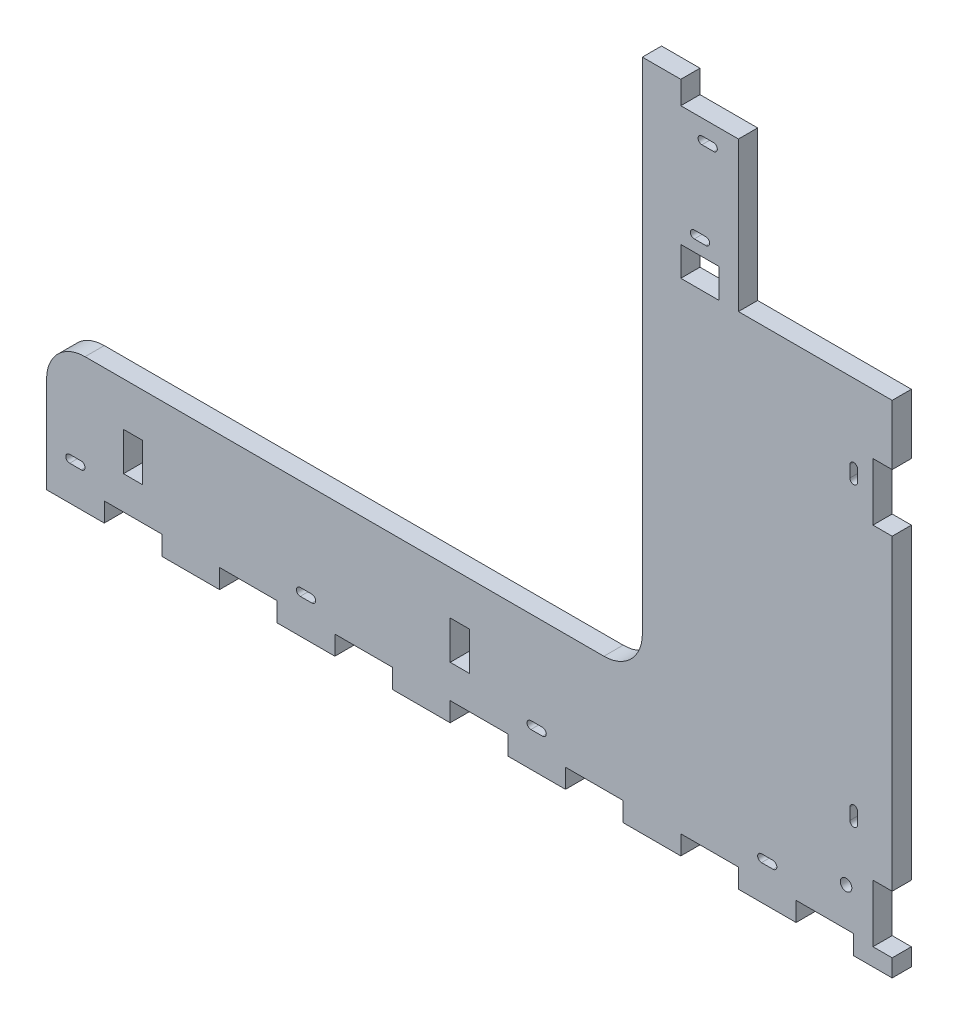
from build123d import *

# Parameters (mm, degrees)
SKETCH1_W           = 220
SKETCH1_H           = 175
BOSS_EXTRUDE1_DEPTH = 5
SKETCH2_W           = 15
SKETCH2_H           = 5
CUT_EXTRUDE1_DEPTH  = 282.15831839
LPATTERN1_COUNT     = 7
LPATTERN1_PITCH     = 30
SKETCH3_W           = 15
SKETCH3_H           = 5.956499639
CUT_EXTRUDE2_DEPTH  = 282.15831839
LPATTERN2_COUNT     = 7
LPATTERN2_PITCH     = 30
SKETCH4_R           = 1.5
CUT_EXTRUDE3_DEPTH  = 282.15831839
SKETCH5_W           = 5
SKETCH5_H           = 15
CUT_EXTRUDE4_DEPTH  = 282.15831839
SKETCH7_W           = 40
SKETCH7_H           = 44.8382835
SKETCH7_W_2         = 10
SKETCH7_H_2         = 7.632708493
CUT_EXTRUDE6_DEPTH  = 282.15831839
SKETCH8_W           = 5
SKETCH8_H           = 10
CUT_EXTRUDE7_DEPTH  = 282.15831839
CUT_EXTRUDE8_DEPTH  = 282.15831839


with BuildPart() as part:
    # Sketch1 → Boss-Extrude1 (new body)
    with BuildSketch(Plane.XY):
        with Locations((-110, 87.5)):
            Rectangle(SKETCH1_W, SKETCH1_H)
    extrude(amount=BOSS_EXTRUDE1_DEPTH)

    # Sketch2 → Cut-Extrude1 (cut, through all)
    with BuildSketch(Plane.XY.offset(5)):
        with Locations((-197.5, 2.5)):
            Rectangle(SKETCH2_W, SKETCH2_H)
    cut_extrude1 = extrude(amount=-CUT_EXTRUDE1_DEPTH, mode=Mode.SUBTRACT)

    # LPattern1: Cut-Extrude1 ×7
    with Locations(*[(i * LPATTERN1_PITCH, 0, 0) for i in range(1, LPATTERN1_COUNT)]):
        add(cut_extrude1, mode=Mode.SUBTRACT)

    # Sketch3 → Cut-Extrude2 (cut, through all)
    with BuildSketch(Plane.XY.offset(5)):
        with Locations((-197.5, 172.021750181)):
            Rectangle(SKETCH3_W, SKETCH3_H)
    cut_extrude2 = extrude(amount=-CUT_EXTRUDE2_DEPTH, mode=Mode.SUBTRACT)

    # LPattern2: Cut-Extrude2 ×7
    with Locations(*[(i * LPATTERN2_PITCH, 0, 0) for i in range(1, LPATTERN2_COUNT)]):
        add(cut_extrude2, mode=Mode.SUBTRACT)

    # Sketch4 → Cut-Extrude3 (cut, through all)
    with BuildSketch(Plane.XY.offset(5)):
        with Locations((-12, 15)):
            Circle(SKETCH4_R)
    extrude(amount=-CUT_EXTRUDE3_DEPTH, mode=Mode.SUBTRACT)

    # Sketch5 → Cut-Extrude4 (cut, through all)
    with BuildSketch(Plane(origin=(0, 0, 0), x_dir=(-1, 0, 0), z_dir=(0, 0, -1))):
        with Locations((2.5, 107.048065362)):
            Rectangle(SKETCH5_W, SKETCH5_H)
        with Locations((2.5, 12.048065362)):
            Rectangle(SKETCH5_W, SKETCH5_H)
    extrude(amount=-CUT_EXTRUDE4_DEPTH, mode=Mode.SUBTRACT)

    # Sketch7 → Cut-Extrude6 (cut, through all)
    with BuildSketch(Plane.XY.offset(5)):
        with Locations((-20, 152.58085825)):
            Rectangle(SKETCH7_W, SKETCH7_H)
        with Locations((-50, 133.978070747)):
            Rectangle(SKETCH7_W_2, SKETCH7_H_2)
    extrude(amount=-CUT_EXTRUDE6_DEPTH, mode=Mode.SUBTRACT)

    # Sketch8 → Cut-Extrude7 (cut, through all)
    with BuildSketch(Plane.XY.offset(5)):
        with BuildLine():
            Line((-220, 175), (-65, 175))
            Line((-65, 175), (-65, 45))
            ThreePointArc((-65, 45), (-67.928932188, 37.928932188), (-75, 35))
            Line((-75, 35), (-210, 35))
            ThreePointArc((-210, 35), (-217.071067812, 32.071067812), (-220, 25))
            Line((-220, 25), (-220, 175))
        make_face()
        with Locations((-197.5, 18.629836595)):
            Rectangle(SKETCH8_W, SKETCH8_H)
        with Locations((-112.5, 18.629836595)):
            Rectangle(SKETCH8_W, SKETCH8_H)
    extrude(amount=-CUT_EXTRUDE7_DEPTH, mode=Mode.SUBTRACT)

    # Sketch9 → Cut-Extrude8 (cut, through all)
    with BuildSketch(Plane.XY.offset(5)):
        with BuildLine():
            Line((-214, 11), (-211, 11))
            ThreePointArc((-211, 11), (-210, 10), (-211, 9))
            Line((-211, 9), (-214, 9))
            ThreePointArc((-214, 9), (-215, 10), (-214, 11))
        make_face()
        with BuildLine():
            Line((-154, 11), (-151, 11))
            ThreePointArc((-151, 11), (-150, 10), (-151, 9))
            Line((-151, 9), (-154, 9))
            ThreePointArc((-154, 9), (-155, 10), (-154, 11))
        make_face()
        with BuildLine():
            Line((-94, 11), (-91, 11))
            ThreePointArc((-91, 11), (-90, 10), (-91, 9))
            Line((-91, 9), (-94, 9))
            ThreePointArc((-94, 9), (-95, 10), (-94, 11))
        make_face()
        with BuildLine():
            Line((-34, 11), (-31, 11))
            ThreePointArc((-31, 11), (-30, 10), (-31, 9))
            Line((-31, 9), (-34, 9))
            ThreePointArc((-34, 9), (-35, 10), (-34, 11))
        make_face()
        with BuildLine():
            Line((-11, 30), (-11, 33))
            ThreePointArc((-11, 33), (-10, 34), (-9, 33))
            Line((-9, 33), (-9, 30))
            ThreePointArc((-9, 30), (-10, 29), (-11, 30))
        make_face()
        with BuildLine():
            Line((-11, 107.1617165), (-11, 110.1617165))
            ThreePointArc((-11, 110.1617165), (-10, 111.1617165), (-9, 110.1617165))
            Line((-9, 110.1617165), (-9, 107.1617165))
            ThreePointArc((-9, 107.1617165), (-10, 106.1617165), (-11, 107.1617165))
        make_face()
        with BuildLine():
            Line((-51.5, 142.794424993), (-48.5, 142.794424993))
            ThreePointArc((-48.5, 142.794424993), (-47.5, 141.794424993), (-48.5, 140.794424993))
            Line((-48.5, 140.794424993), (-51.5, 140.794424993))
            ThreePointArc((-51.5, 140.794424993), (-52.5, 141.794424993), (-51.5, 142.794424993))
        make_face()
        with BuildLine():
            Line((-49.5, 165), (-46.5, 165))
            ThreePointArc((-46.5, 165), (-45.5, 164), (-46.5, 163))
            Line((-46.5, 163), (-49.5, 163))
            ThreePointArc((-49.5, 163), (-50.5, 164), (-49.5, 165))
        make_face()
        with BuildLine():
            Line((-51.5, 134.1617165), (-48.5, 134.1617165))
            ThreePointArc((-48.5, 134.1617165), (-47.5, 133.1617165), (-48.5, 132.1617165))
            Line((-48.5, 132.1617165), (-51.5, 132.1617165))
            ThreePointArc((-51.5, 132.1617165), (-52.5, 133.1617165), (-51.5, 134.1617165))
        make_face()
    extrude(amount=-CUT_EXTRUDE8_DEPTH, mode=Mode.SUBTRACT)


solid = part.part
